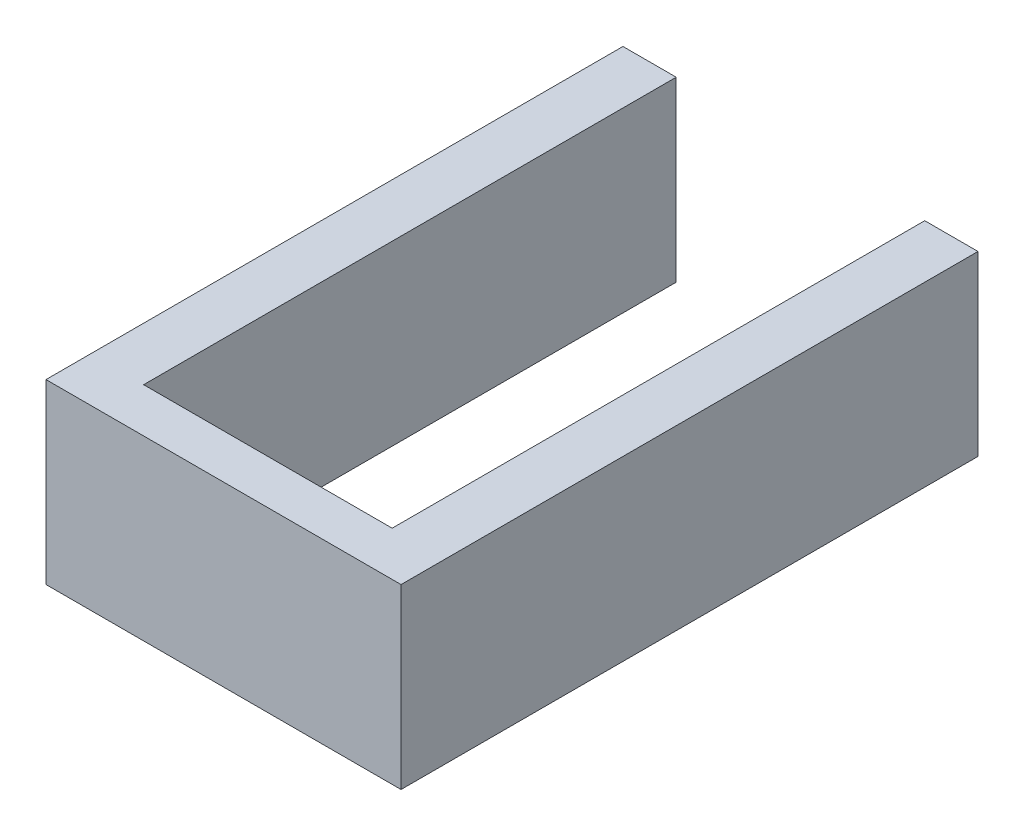
from build123d import *

# Parameters (mm, degrees)
SKETCH1_W           = 40
SKETCH1_H           = 20
BOSS_EXTRUDE1_DEPTH = 5
SKETCH2_W           = 6
SKETCH2_H           = 20
BOSS_EXTRUDE2_DEPTH = 60


with BuildPart() as part:
    # Sketch1 → Boss-Extrude1 (new body)
    with BuildSketch(Plane.XY):
        with Locations((1.041666667, 0.677083333)):
            Rectangle(SKETCH1_W, SKETCH1_H)
    extrude(amount=BOSS_EXTRUDE1_DEPTH)

    # Sketch2 → Boss-Extrude2 (add)
    with BuildSketch(Plane(origin=(0, 0, 0), x_dir=(-1, 0, 0), z_dir=(0, 0, -1))):
        with Locations((-18.041666667, 0.677083333)):
            Rectangle(SKETCH2_W, SKETCH2_H)
        with Locations((15.958333333, 0.677083333)):
            Rectangle(SKETCH2_W, SKETCH2_H)
    extrude(amount=BOSS_EXTRUDE2_DEPTH)


solid = part.part
